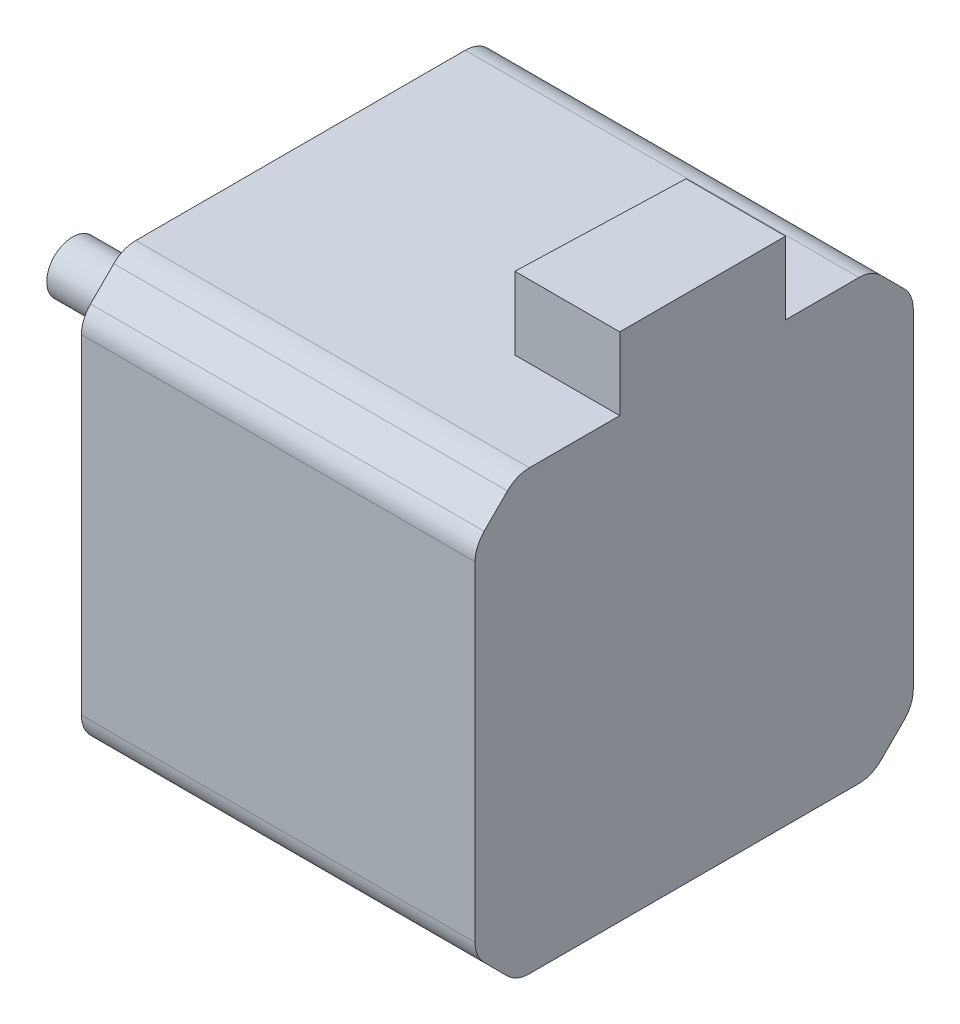
from build123d import *

# Parameters (mm, degrees)
EXTRUDE_2_DEPTH          = 38
SKETCH_2_R               = 11
EXTRUDE_3_DEPTH          = 2
FILLET_1_R               = 1
SKETCH_3_R               = 2.5
EXTRUDE_4_DEPTH          = 20
SKETCH_4_R               = 1.5
CUT_EXTRUDE_1_DEPTH      = 4.5
PATTERN_CIRCULAR_1_COUNT = 4
EXTRUDE_5_DEPTH          = 7


with BuildPart() as part:
    # 草图1 → 凸台-拉伸2 (new body)
    with BuildSketch(Plane(origin=(0, 0, 0), x_dir=(0, 0, -1), z_dir=(1, 0, 0))):
        with BuildLine():
            Line((0.878679656, 39.178679656), (3.121320344, 41.421320344))
            ThreePointArc((3.121320344, 41.421320344), (4.09459039, 42.071638598), (5.242640687, 42.3))
            Line((5.242640687, 42.3), (37.057359313, 42.3))
            ThreePointArc((37.057359313, 42.3), (38.20540961, 42.071638598), (39.178679656, 41.421320344))
            Line((39.178679656, 41.421320344), (41.421320344, 39.178679656))
            ThreePointArc((41.421320344, 39.178679656), (42.071638598, 38.20540961), (42.3, 37.057359313))
            Line((42.3, 37.057359313), (42.3, 5.242640687))
            ThreePointArc((42.3, 5.242640687), (42.071638598, 4.09459039), (41.421320344, 3.121320344))
            Line((41.421320344, 3.121320344), (39.178679656, 0.878679656))
            ThreePointArc((39.178679656, 0.878679656), (38.20540961, 0.228361402), (37.057359313, 0))
            Line((37.057359313, 0), (5.242640687, 0))
            ThreePointArc((5.242640687, 0), (4.09459039, 0.228361402), (3.121320344, 0.878679656))
            Line((3.121320344, 0.878679656), (0.878679656, 3.121320344))
            ThreePointArc((0.878679656, 3.121320344), (0.228361402, 4.09459039), (0, 5.242640687))
            Line((0, 5.242640687), (0, 37.057359313))
            ThreePointArc((0, 37.057359313), (0.228361402, 38.20540961), (0.878679656, 39.178679656))
        make_face()
    extrude(amount=EXTRUDE_2_DEPTH)

    # 草图2 → 凸台-拉伸3 (add)
    with BuildSketch(Plane.ZY):
        with Locations((-21.15, 21.15)):
            Circle(SKETCH_2_R)
    extrude(amount=EXTRUDE_3_DEPTH)

    # 圆角1
    fillet_1_edges = [part.edges().sort_by_distance(p)[0] for p in [
        (-2, 21.15, -32.15),
    ]]
    fillet(fillet_1_edges, radius=FILLET_1_R)

    # 草图3 → 凸台-拉伸4 (add)
    with BuildSketch(Plane.ZY.offset(2)):
        with Locations((-21.15, 21.15)):
            Circle(SKETCH_3_R)
    extrude(amount=EXTRUDE_4_DEPTH)

    # 草图4 → 切除-拉伸1 (cut)
    with BuildSketch(Plane.ZY):
        with Locations((-36.65, 36.65)):
            Circle(SKETCH_4_R)
    cut_extrude_1 = extrude(amount=-CUT_EXTRUDE_1_DEPTH, mode=Mode.SUBTRACT)

    # 阵列(圆周)1: 切除-拉伸1 ×4 about axis
    pattern_circular_1_axis = Axis((0, 21.15, -21.15), (1, 0, 0))
    for i in range(1, PATTERN_CIRCULAR_1_COUNT):
        add(cut_extrude_1.rotate(pattern_circular_1_axis, i * 360 / PATTERN_CIRCULAR_1_COUNT), mode=Mode.SUBTRACT)

    # 草图6 → 凸台-拉伸5 (add)
    with BuildSketch(Plane(origin=(0, 42.3, 0), x_dir=(1, 0, 0), z_dir=(0, 1, 0))):
        Polygon((28.4, 29.967521896), (38, 29.967521896), (38, 13.967521896), (27.87263434, 13.967521896), align=None)
    extrude(amount=EXTRUDE_5_DEPTH)


solid = part.part
